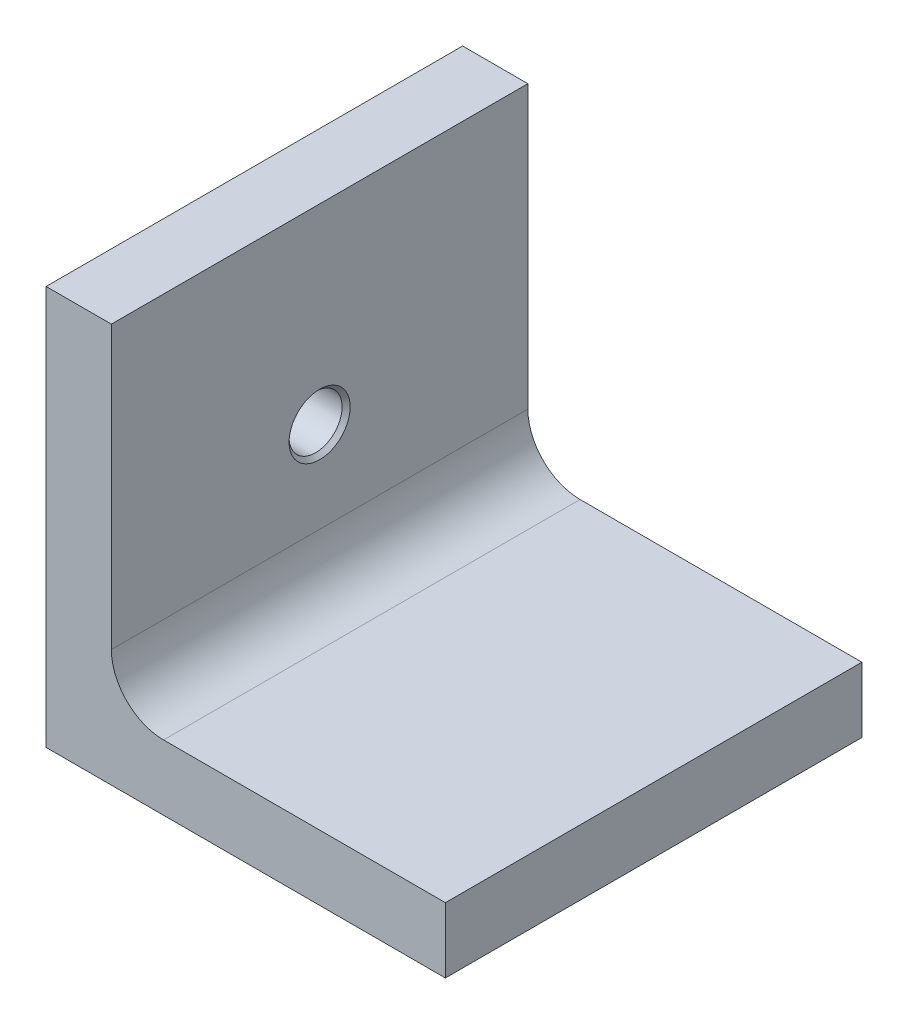
from build123d import *

# Parameters (mm, degrees)
BOSS_EXTRUDE1_DEPTH = 19.05


with BuildPart() as part:
    # Sketch1 → Boss-Extrude1 (new, symmetric)
    with BuildSketch(Plane.XY):
        with BuildLine():
            Line((0, 36.5252), (0, 0))
            Line((0, 0), (36.5252, 0))
            Line((36.5252, 0), (36.5252, 5.969))
            Line((36.5252, 5.969), (10.7442, 5.969))
            ThreePointArc((10.7442, 5.969), (7.367623698, 7.367623698), (5.969, 10.7442))
            Line((5.969, 10.7442), (5.969, 36.5252))
            Line((5.969, 36.5252), (0, 36.5252))
        make_face()
    extrude(amount=BOSS_EXTRUDE1_DEPTH, both=True)

    # Sketch9 → #11 (0.191) Diameter Hole1 (revolve, cut)
    with BuildSketch(Plane.ZX.offset(19.05)):
        Polygon((0, 0), (0, 5.969), (2.794, 5.969), (2.4257, 5.6007), (2.4257, 0.3683), (2.794, 0), align=None)
    revolve(axis=Axis((-6.35, 19.05, 0), (1, 0, 0)), mode=Mode.SUBTRACT)


solid = part.part
